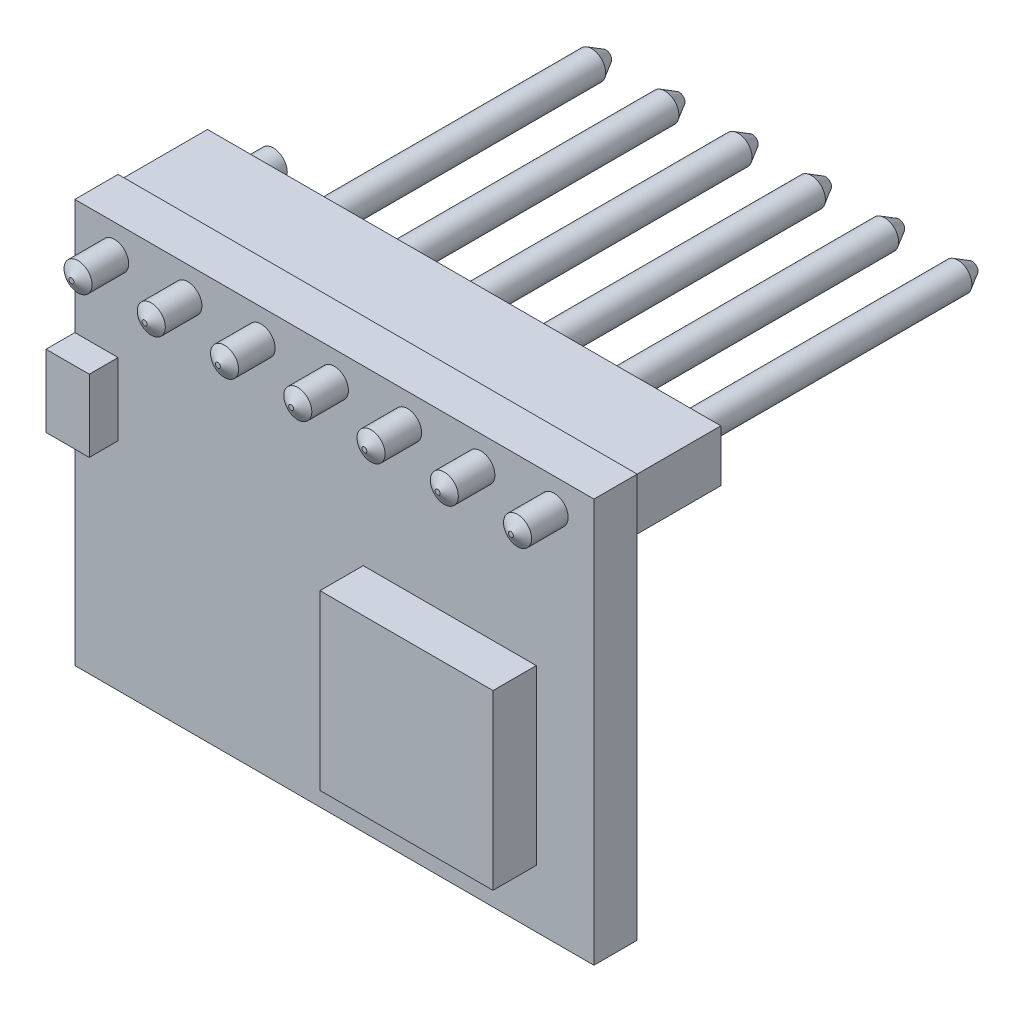
from build123d import *
from OCP.BRepFilletAPI import BRepFilletAPI_MakeChamfer

# Parameters (mm, degrees)
ESQUISSE1_W             = 18
ESQUISSE1_H             = 14
BOSS_EXTRU_1_DEPTH      = 1.5
ESQUISSE4_W             = 1.5
ESQUISSE4_H             = 2.5
BOSS_EXTRU_4_DEPTH      = 1
ESQUISSE5_W             = 17.8
ESQUISSE5_H             = 1.8
BOSS_EXTRU_5_DEPTH      = 3
BOSS_EXTRU_6_DEPTH      = 10
BOSS_EXTRU_6_DEPTH_BACK = 6
ESQUISSE6_R             = 0.486228561
CHANFREIN2_SIZE         = 0.5
CHANFREIN2_SIZE2        = 0.288675135
ESQUISSE7_W             = 2.5
ESQUISSE7_H             = 9.31757076
ENL_V_MAT_EXTRU_1_DEPTH = 27.195610319
CHANFREIN3_SIZE         = 0.4
CHANFREIN3_SIZE2        = 0.230940108
ESQUISSE8_W             = 6
ESQUISSE8_H             = 6
BOSS_EXTRU_7_DEPTH      = 1.5


with BuildPart() as part:
    # Esquisse1 → Boss.-Extru.1 (new body)
    with BuildSketch(Plane.XY):
        with Locations((9, 7)):
            Rectangle(ESQUISSE1_W, ESQUISSE1_H)
    extrude(amount=BOSS_EXTRU_1_DEPTH)

    # Esquisse4 → Boss.-Extru.4 (add)
    with BuildSketch(Plane.XY.offset(1.5)):
        with Locations((0.75, 8.75)):
            Rectangle(ESQUISSE4_W, ESQUISSE4_H)
    extrude(amount=BOSS_EXTRU_4_DEPTH)

    # Esquisse5 → Boss.-Extru.5 (add)
    with BuildSketch(Plane(origin=(0, 0, 0), x_dir=(-1, 0, 0), z_dir=(0, 0, -1))):
        with Locations((-9, 13)):
            Rectangle(ESQUISSE5_W, ESQUISSE5_H)
    extrude(amount=BOSS_EXTRU_5_DEPTH)

    # Esquisse6 → Boss.-Extru.6 (add, two sides: drawn at the far end of the back side and taken through both)
    with BuildSketch(Plane(origin=(0, 0, -3), x_dir=(-1, 0, 0), z_dir=(0, 0, -1)).offset(-BOSS_EXTRU_6_DEPTH_BACK)):
        with Locations((-1.38, 13)):
            Circle(ESQUISSE6_R)
        with Locations((-3.92, 13)):
            Circle(ESQUISSE6_R)
        with Locations((-6.46, 13)):
            Circle(ESQUISSE6_R)
        with Locations((-9, 13)):
            Circle(ESQUISSE6_R)
        with Locations((-11.54, 13)):
            Circle(ESQUISSE6_R)
        with Locations((-14.08, 13)):
            Circle(ESQUISSE6_R)
        with Locations((-16.62, 13)):
            Circle(ESQUISSE6_R)
    extrude(amount=BOSS_EXTRU_6_DEPTH + BOSS_EXTRU_6_DEPTH_BACK)

    # Chanfrein2: one chamfer whose edges measure the first distance from different faces: ONE call of the kernel's chamfer builder (chamfer() names one face for all edges)
    chanfrein2_edges_1 = [part.edges().sort_by_distance(p)[0] for p in [
        (1.866228561, 13, -13),
    ]]
    chanfrein2_side_1 = [part.faces().sort_by_distance(p)[0] for p in [
        (1.866228561, 13, -8),
    ]]
    chanfrein2_edges_2 = [part.edges().sort_by_distance(p)[0] for p in [
        (4.406228561, 13, -13),
    ]]
    chanfrein2_side_2 = [part.faces().sort_by_distance(p)[0] for p in [
        (4.406228561, 13, -8),
    ]]
    chanfrein2_edges_3 = [part.edges().sort_by_distance(p)[0] for p in [
        (6.946228561, 13, -13),
    ]]
    chanfrein2_side_3 = [part.faces().sort_by_distance(p)[0] for p in [
        (6.946228561, 13, -8),
    ]]
    chanfrein2_edges_4 = [part.edges().sort_by_distance(p)[0] for p in [
        (9.486228561, 13, -13),
    ]]
    chanfrein2_side_4 = [part.faces().sort_by_distance(p)[0] for p in [
        (9.486228561, 13, -8),
    ]]
    chanfrein2_edges_5 = [part.edges().sort_by_distance(p)[0] for p in [
        (12.026228561, 13, -13),
    ]]
    chanfrein2_side_5 = [part.faces().sort_by_distance(p)[0] for p in [
        (12.026228561, 13, -8),
    ]]
    chanfrein2_edges_6 = [part.edges().sort_by_distance(p)[0] for p in [
        (14.566228561, 13, -13),
    ]]
    chanfrein2_side_6 = [part.faces().sort_by_distance(p)[0] for p in [
        (14.566228561, 13, -8),
    ]]
    chanfrein2_edges_7 = [part.edges().sort_by_distance(p)[0] for p in [
        (17.106228561, 13, -13),
    ]]
    chanfrein2_side_7 = [part.faces().sort_by_distance(p)[0] for p in [
        (17.106228561, 13, -8),
    ]]
    chanfrein2 = BRepFilletAPI_MakeChamfer(part.part.solid().wrapped)
    for e in chanfrein2_edges_1:
        chanfrein2.Add(CHANFREIN2_SIZE, CHANFREIN2_SIZE2, e.wrapped, chanfrein2_side_1[0].wrapped)  # the first distance lies on this face
    for e in chanfrein2_edges_2:
        chanfrein2.Add(CHANFREIN2_SIZE, CHANFREIN2_SIZE2, e.wrapped, chanfrein2_side_2[0].wrapped)  # the first distance lies on this face
    for e in chanfrein2_edges_3:
        chanfrein2.Add(CHANFREIN2_SIZE, CHANFREIN2_SIZE2, e.wrapped, chanfrein2_side_3[0].wrapped)  # the first distance lies on this face
    for e in chanfrein2_edges_4:
        chanfrein2.Add(CHANFREIN2_SIZE, CHANFREIN2_SIZE2, e.wrapped, chanfrein2_side_4[0].wrapped)  # the first distance lies on this face
    for e in chanfrein2_edges_5:
        chanfrein2.Add(CHANFREIN2_SIZE, CHANFREIN2_SIZE2, e.wrapped, chanfrein2_side_5[0].wrapped)  # the first distance lies on this face
    for e in chanfrein2_edges_6:
        chanfrein2.Add(CHANFREIN2_SIZE, CHANFREIN2_SIZE2, e.wrapped, chanfrein2_side_6[0].wrapped)  # the first distance lies on this face
    for e in chanfrein2_edges_7:
        chanfrein2.Add(CHANFREIN2_SIZE, CHANFREIN2_SIZE2, e.wrapped, chanfrein2_side_7[0].wrapped)  # the first distance lies on this face
    add(Compound.cast(chanfrein2.Shape()), mode=Mode.REPLACE)

    # Esquisse7 → Enlèv. mat.-Extru.1 (cut, through all)
    with BuildSketch(Plane(origin=(0, 13.9, 0), x_dir=(1, 0, 0), z_dir=(0, 1, 0))):
        with Locations((1.25, 8.65878538)):
            Rectangle(ESQUISSE7_W, ESQUISSE7_H)
    extrude(amount=-ENL_V_MAT_EXTRU_1_DEPTH, mode=Mode.SUBTRACT)

    # Chanfrein3: one chamfer whose edges measure the first distance from different faces: ONE call of the kernel's chamfer builder (chamfer() names one face for all edges)
    chanfrein3_edges_1 = [part.edges().sort_by_distance(p)[0] for p in [
        (1.866228561, 13, 3),
    ]]
    chanfrein3_side_1 = [part.faces().sort_by_distance(p)[0] for p in [
        (1.38, 13, 3),
    ]]
    chanfrein3_edges_2 = [part.edges().sort_by_distance(p)[0] for p in [
        (4.406228561, 13, 3),
    ]]
    chanfrein3_side_2 = [part.faces().sort_by_distance(p)[0] for p in [
        (3.92, 13, 3),
    ]]
    chanfrein3_edges_3 = [part.edges().sort_by_distance(p)[0] for p in [
        (6.946228561, 13, 3),
    ]]
    chanfrein3_side_3 = [part.faces().sort_by_distance(p)[0] for p in [
        (6.46, 13, 3),
    ]]
    chanfrein3_edges_4 = [part.edges().sort_by_distance(p)[0] for p in [
        (9.486228561, 13, 3),
    ]]
    chanfrein3_side_4 = [part.faces().sort_by_distance(p)[0] for p in [
        (9, 13, 3),
    ]]
    chanfrein3_edges_5 = [part.edges().sort_by_distance(p)[0] for p in [
        (12.026228561, 13, 3),
    ]]
    chanfrein3_side_5 = [part.faces().sort_by_distance(p)[0] for p in [
        (11.54, 13, 3),
    ]]
    chanfrein3_edges_6 = [part.edges().sort_by_distance(p)[0] for p in [
        (14.566228561, 13, 3),
    ]]
    chanfrein3_side_6 = [part.faces().sort_by_distance(p)[0] for p in [
        (14.08, 13, 3),
    ]]
    chanfrein3_edges_7 = [part.edges().sort_by_distance(p)[0] for p in [
        (17.106228561, 13, 3),
    ]]
    chanfrein3_side_7 = [part.faces().sort_by_distance(p)[0] for p in [
        (16.62, 13, 3),
    ]]
    chanfrein3 = BRepFilletAPI_MakeChamfer(part.part.solid().wrapped)
    for e in chanfrein3_edges_1:
        chanfrein3.Add(CHANFREIN3_SIZE, CHANFREIN3_SIZE2, e.wrapped, chanfrein3_side_1[0].wrapped)  # the first distance lies on this face
    for e in chanfrein3_edges_2:
        chanfrein3.Add(CHANFREIN3_SIZE, CHANFREIN3_SIZE2, e.wrapped, chanfrein3_side_2[0].wrapped)  # the first distance lies on this face
    for e in chanfrein3_edges_3:
        chanfrein3.Add(CHANFREIN3_SIZE, CHANFREIN3_SIZE2, e.wrapped, chanfrein3_side_3[0].wrapped)  # the first distance lies on this face
    for e in chanfrein3_edges_4:
        chanfrein3.Add(CHANFREIN3_SIZE, CHANFREIN3_SIZE2, e.wrapped, chanfrein3_side_4[0].wrapped)  # the first distance lies on this face
    for e in chanfrein3_edges_5:
        chanfrein3.Add(CHANFREIN3_SIZE, CHANFREIN3_SIZE2, e.wrapped, chanfrein3_side_5[0].wrapped)  # the first distance lies on this face
    for e in chanfrein3_edges_6:
        chanfrein3.Add(CHANFREIN3_SIZE, CHANFREIN3_SIZE2, e.wrapped, chanfrein3_side_6[0].wrapped)  # the first distance lies on this face
    for e in chanfrein3_edges_7:
        chanfrein3.Add(CHANFREIN3_SIZE, CHANFREIN3_SIZE2, e.wrapped, chanfrein3_side_7[0].wrapped)  # the first distance lies on this face
    add(Compound.cast(chanfrein3.Shape()), mode=Mode.REPLACE)

    # Esquisse8 → Boss.-Extru.7 (add)
    with BuildSketch(Plane.XY.offset(1.5)):
        with Locations((13, 5)):
            Rectangle(ESQUISSE8_W, ESQUISSE8_H)
    extrude(amount=BOSS_EXTRU_7_DEPTH)


solid = part.part
